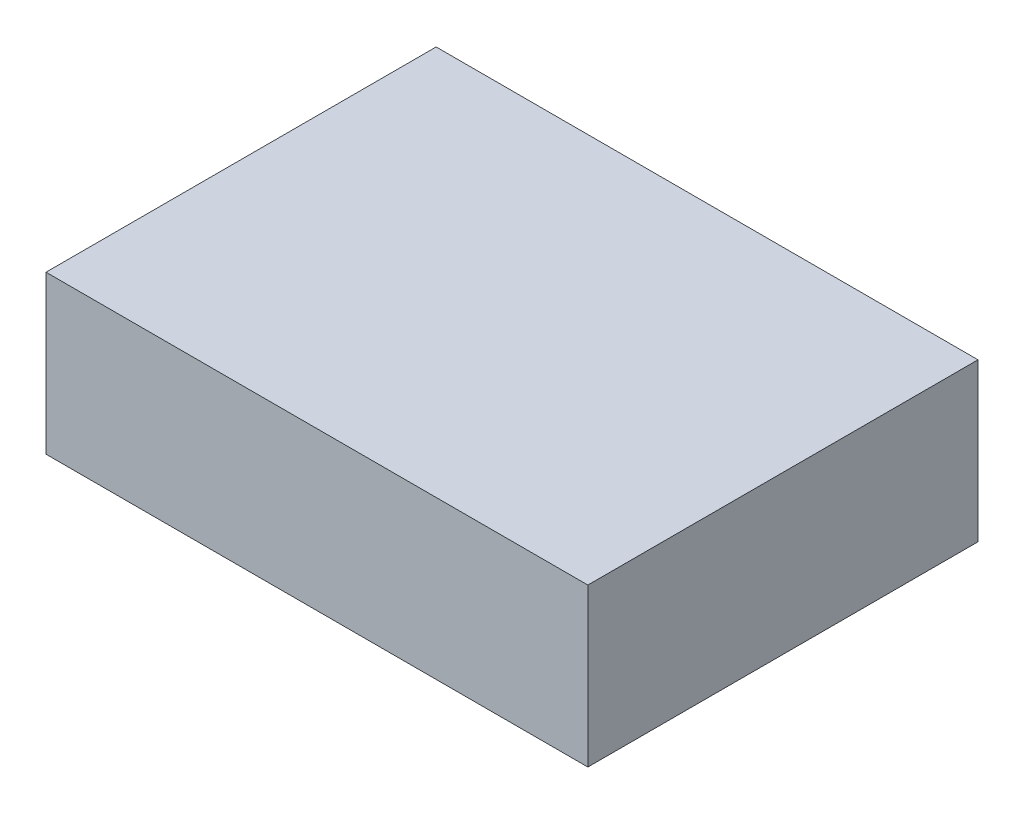
from build123d import *

# Parameters (mm, degrees)
SKETCH1_W           = 69.85
SKETCH1_H           = 50.292
BOSS_EXTRUDE1_DEPTH = 20.32


with BuildPart() as part:
    # Sketch1 → Boss-Extrude1 (new body)
    with BuildSketch(Plane(origin=(0, 0, 0), x_dir=(1, 0, 0), z_dir=(0, 1, 0))):
        Rectangle(SKETCH1_W, SKETCH1_H)
    extrude(amount=BOSS_EXTRUDE1_DEPTH)


solid = part.part
